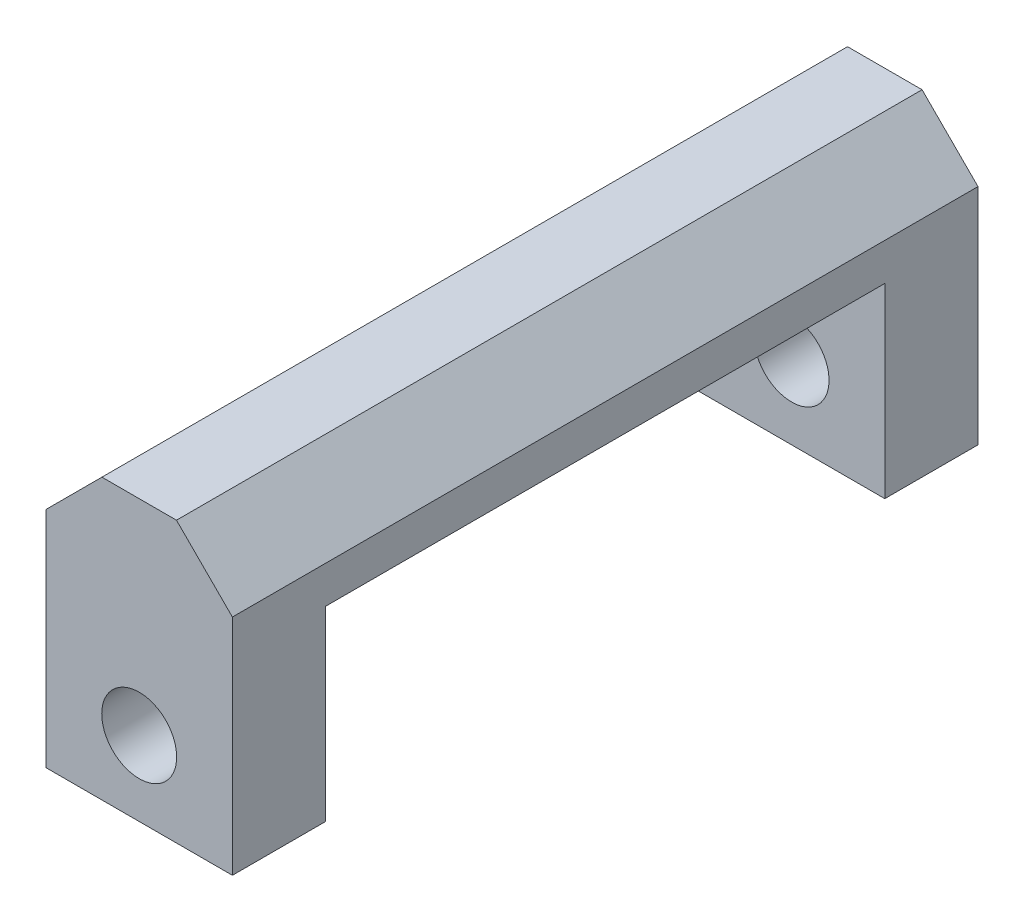
from build123d import *

# Parameters (mm, degrees)
BOSS_EXTRUDE1_DEPTH         = 12.7
TAP_DRILL_FOR_1_4_20_TAP1_D = 5.1054
CHAMFER1_SIZE               = 3.81


with BuildPart() as part:
    # Sketch1 → Boss-Extrude1 (new body)
    with BuildSketch(Plane(origin=(0, 0, 0), x_dir=(0, 0, -1), z_dir=(1, 0, 0))):
        Polygon((25.4, 0), (-25.4, 0), (-25.4, -19.05), (-19.05, -19.05), (-19.05, -6.35), (19.05, -6.35), (19.05, -19.05), (25.4, -19.05), align=None)
    extrude(amount=BOSS_EXTRUDE1_DEPTH)

    # Tap Drill for 1/4-20 Tap1 (through all)
    with Locations(Plane(origin=(6.35, -13.97, -25.4), x_dir=(-1, 0, 0), z_dir=(0, 0, -1))):
        with Locations((0, 0)):
            Hole(TAP_DRILL_FOR_1_4_20_TAP1_D / 2)

    # Chamfer1
    chamfer1_edges = [part.edges().sort_by_distance(p)[0] for p in [
        (12.7, 0, 0),
        (0, 0, 0),
    ]]
    chamfer(chamfer1_edges, length=CHAMFER1_SIZE)


solid = part.part
